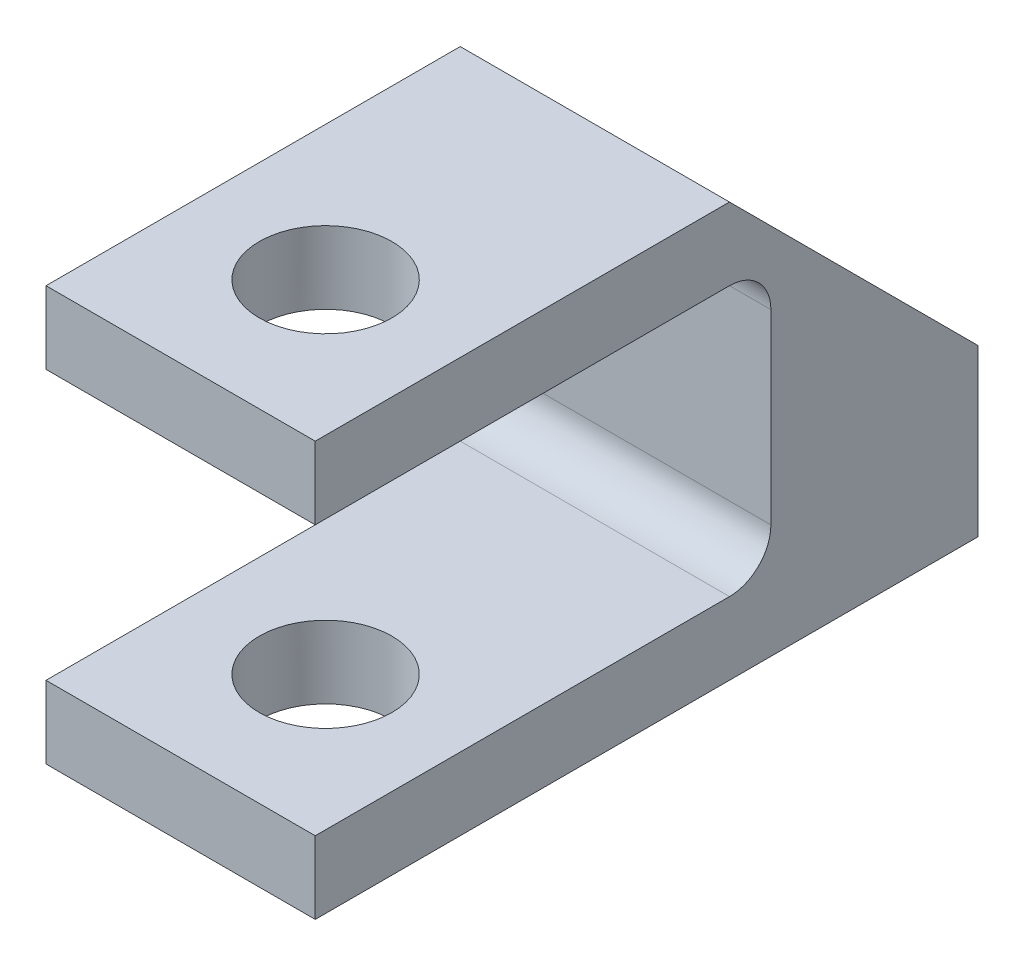
from build123d import *

# Parameters (mm, degrees)
SKETCH1_W           = 16
SKETCH1_H           = 10
BOSS_EXTRUDE1_DEPTH = 6.5
CUT_EXTRUDE1_DEPTH  = 12.456439237
SKETCH3_W           = 14
SKETCH3_H           = 6.5
CUT_EXTRUDE2_DEPTH  = 11
SKETCH4_R           = 1.6
CUT_EXTRUDE3_DEPTH  = 15.361406616
FILLET1_R           = 1


with BuildPart() as part:
    # Sketch1 → Boss-Extrude1 (new body)
    with BuildSketch(Plane(origin=(0, 0, 0), x_dir=(0, 0, -1), z_dir=(1, 0, 0))):
        Rectangle(SKETCH1_W, SKETCH1_H)
    extrude(amount=-BOSS_EXTRUDE1_DEPTH)

    # Sketch2 → Cut-Extrude1 (cut, through all)
    with BuildSketch(Plane(origin=(0, 0, 0), x_dir=(0, 0, -1), z_dir=(1, 0, 0))):
        Polygon((8, -1), (2, 5), (8, 5), align=None)
    extrude(amount=-CUT_EXTRUDE1_DEPTH, mode=Mode.SUBTRACT)

    # Sketch3 → Cut-Extrude2 (cut)
    with BuildSketch(Plane.XY.offset(8)):
        with Locations((-3.25, 0)):
            Rectangle(SKETCH3_W, SKETCH3_H)
    extrude(amount=-CUT_EXTRUDE2_DEPTH, mode=Mode.SUBTRACT)

    # Sketch4 → Cut-Extrude3 (cut, through all)
    with BuildSketch(Plane(origin=(0, 5, 0), x_dir=(1, 0, 0), z_dir=(0, 1, 0))):
        with Locations(Location((-3.25, -4.5, 0), (0, 0, 270))):
            Circle(SKETCH4_R)
    extrude(amount=-CUT_EXTRUDE3_DEPTH, mode=Mode.SUBTRACT)

    # Fillet1
    fillet1_edges = [part.edges().sort_by_distance(p)[0] for p in [
        (-3.25, -3.25, -3),
        (-3.25, 3.25, -3),
    ]]
    fillet(fillet1_edges, radius=FILLET1_R)


solid = part.part
